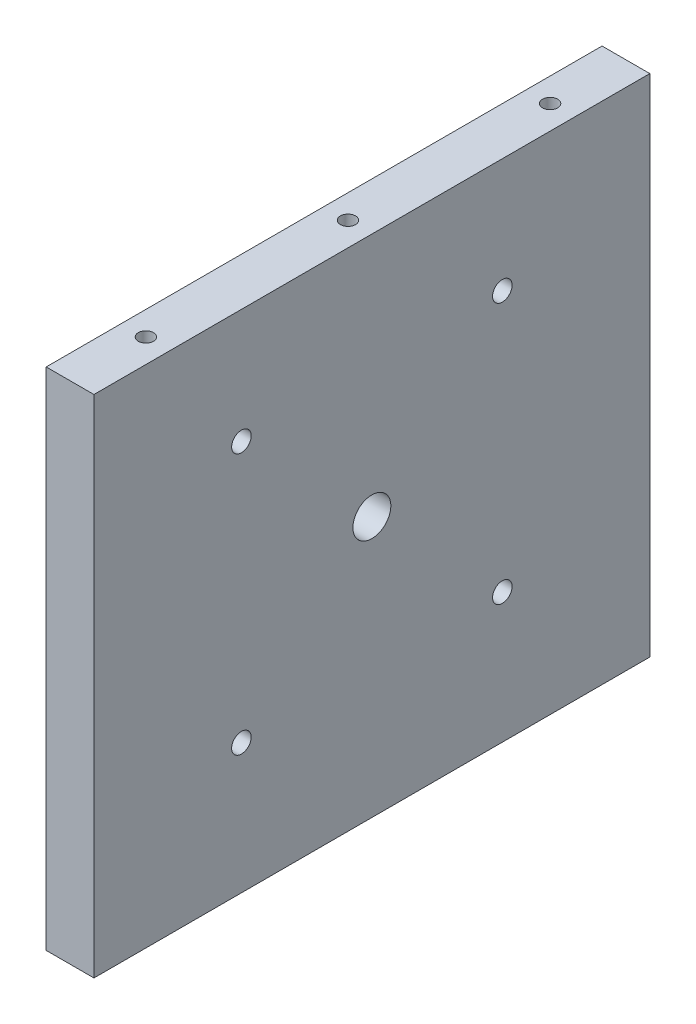
from build123d import *

# Parameters (mm, degrees)
SKETCH1_W                           = 139.7
SKETCH1_H                           = 127
BOSS_EXTRUDE1_DEPTH                 = 12
F_8_CLEARANCE_HOLE1_D               = 4.9149
SKETCH2_R                           = 43.18
SKETCH2_R_2                         = 4.7625
CUT_EXTRUDE1_DEPTH                  = 1.27
SKETCH2_4_R                         = 4.7625
CUT_EXTRUDE2_DEPTH                  = 96.159195562
TAP_DRILL_FOR_10_24_TAP1_AT_2_COUNT = 2
TAP_DRILL_FOR_10_24_TAP1_AT_2_PITCH = 50.8
TAP_DRILL_FOR_10_24_TAP1_AT_3_COUNT = 2
TAP_DRILL_FOR_10_24_TAP1_AT_3_PITCH = 101.6
SKETCH8_R                           = 5.715
CUT_EXTRUDE3_DEPTH                  = 0.889


with BuildPart() as part:
    # Sketch1 → Boss-Extrude1 (new body)
    with BuildSketch(Plane(origin=(0, 0, 0), x_dir=(0, 0, -1), z_dir=(1, 0, 0))):
        Rectangle(SKETCH1_W, SKETCH1_H)
    extrude(amount=BOSS_EXTRUDE1_DEPTH)

    # #8 Clearance Hole1 (through all)
    with Locations(Plane.ZY):
        with Locations((-32.786915098, 34.756915098), (32.786915098, 34.756915098), (32.786915098, -30.816915098), (-32.786915098, -30.816915098)):
            Hole(F_8_CLEARANCE_HOLE1_D / 2)

    # Sketch2 → Cut-Extrude1 (cut)
    with BuildSketch(Plane.ZY):
        with Locations((0, 1.97)):
            Circle(SKETCH2_R)
        with Locations((0, 1.97)):
            Circle(SKETCH2_R_2, mode=Mode.SUBTRACT)
    extrude(amount=-CUT_EXTRUDE1_DEPTH, mode=Mode.SUBTRACT)

    # Sketch2<4> → Cut-Extrude2 (cut, through all)
    with BuildSketch(Plane.ZY):
        with Locations((0, 1.97)):
            Circle(SKETCH2_4_R)
    extrude(amount=-CUT_EXTRUDE2_DEPTH, mode=Mode.SUBTRACT)

    # Sketch7 → Tap Drill for #10-24 Tap1 (revolve, cut)
    with BuildSketch(Plane(origin=(6, -63.5, -50.8), x_dir=(0, 0, -1), z_dir=(1, 0, 0))):
        Polygon((0, 0), (0, 13.840824014), (1.89865, 12.7), (1.89865, 0), align=None)
    tap_drill_for_10_24_tap1 = revolve(axis=Axis((6, -69.85, -50.8), (0, 1, 0)), mode=Mode.SUBTRACT)

    # Tap Drill for #10-24 Tap1 at 2: Tap Drill for #10-24 Tap1 ×2
    with Locations(*[(0, 0, i * TAP_DRILL_FOR_10_24_TAP1_AT_2_PITCH) for i in range(1, TAP_DRILL_FOR_10_24_TAP1_AT_2_COUNT)]):
        add(tap_drill_for_10_24_tap1, mode=Mode.SUBTRACT)

    # Tap Drill for #10-24 Tap1 at 3: Tap Drill for #10-24 Tap1 ×2
    with Locations(*[(0, 0, i * TAP_DRILL_FOR_10_24_TAP1_AT_3_PITCH) for i in range(1, TAP_DRILL_FOR_10_24_TAP1_AT_3_COUNT)]):
        add(tap_drill_for_10_24_tap1, mode=Mode.SUBTRACT)

    # Mirror1: Tap Drill for #10-24 Tap1 across plane
    add(tap_drill_for_10_24_tap1.mirror(Plane.ZX), mode=Mode.SUBTRACT)

    # Mirror1 copy 1 sketch → Mirror1 copy 1 (revolve, cut)
    with BuildSketch(Plane(origin=(6, 63.5, 0), x_dir=(0, 0, -1), z_dir=(1, 0, 0))):
        Polygon((0, 0), (0, -13.840824014), (1.89865, -12.7), (1.89865, 0), align=None)
    revolve(axis=Axis((6, 69.85, 0), (0, 1, 0)), mode=Mode.SUBTRACT)

    # Mirror1 copy 2 sketch → Mirror1 copy 2 (revolve, cut)
    with BuildSketch(Plane(origin=(6, 63.5, 50.8), x_dir=(0, 0, -1), z_dir=(1, 0, 0))):
        Polygon((0, 0), (0, -13.840824014), (1.89865, -12.7), (1.89865, 0), align=None)
    revolve(axis=Axis((6, 69.85, 50.8), (0, 1, 0)), mode=Mode.SUBTRACT)

    # Sketch8 → Cut-Extrude3 (cut)
    with BuildSketch(Plane.ZY.offset(-1.27)):
        with Locations((0, 1.97)):
            Circle(SKETCH8_R)
    extrude(amount=-CUT_EXTRUDE3_DEPTH, mode=Mode.SUBTRACT)


solid = part.part
